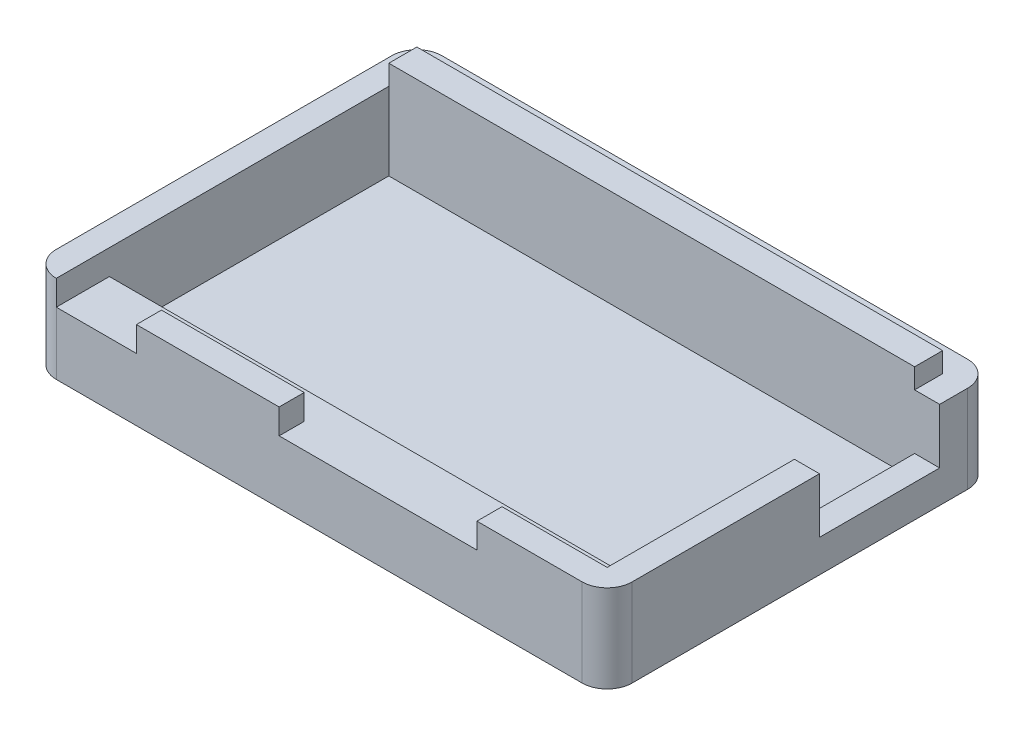
from build123d import *

# Parameters (mm, degrees)
SKETCH1_W            = 57.5
SKETCH1_H            = 38.5
SKETCH1_W_2          = 52.5
SKETCH1_H_2          = 33.5
BOSS_EXTRUDE1_DEPTH  = 10.25
SKETCH10_W           = 52.5
SKETCH10_H           = 33.5
BOSS_EXTRUDE8_DEPTH  = 2.5
SKETCH11_W           = 52.5
SKETCH11_H           = 2.8
BOSS_EXTRUDE9_DEPTH  = 9.75
SKETCH12_W           = 52.5
SKETCH12_H           = 2.8
BOSS_EXTRUDE10_DEPTH = 5.25
SKETCH13_W           = 12
SKETCH13_H           = 5.5
CUT_EXTRUDE1_DEPTH   = 2.5
SKETCH14_W           = 8
SKETCH14_H           = 2.5
SKETCH14_W_2         = 19.75
CUT_EXTRUDE2_DEPTH   = 2.5
SKETCH15_W           = 38.5
SKETCH15_H           = 1.5
CUT_EXTRUDE3_DEPTH   = 57.5
FILLET1_R            = 2.5


with BuildPart() as part:
    # Sketch1 → Boss-Extrude1 (new body)
    with BuildSketch(Plane(origin=(0, 0, 0), x_dir=(1, 0, 0), z_dir=(0, 1, 0))):
        with Locations((28.75, 19.25)):
            Rectangle(SKETCH1_W, SKETCH1_H)
        with Locations((28.75, 19.25)):
            Rectangle(SKETCH1_W_2, SKETCH1_H_2, mode=Mode.SUBTRACT)
    extrude(amount=BOSS_EXTRUDE1_DEPTH)

    # Sketch10 → Boss-Extrude8 (add)
    with BuildSketch(Plane(origin=(0, 0, 0), x_dir=(1, 0, 0), z_dir=(0, 1, 0))):
        with Locations((28.75, 19.25)):
            Rectangle(SKETCH10_W, SKETCH10_H)
    extrude(amount=BOSS_EXTRUDE8_DEPTH)

    # Sketch11 → Boss-Extrude9 (add)
    with BuildSketch(Plane(origin=(0, 2.5, 0), x_dir=(1, 0, 0), z_dir=(0, 1, 0))):
        with Locations((28.75, 34.6)):
            Rectangle(SKETCH11_W, SKETCH11_H)
    extrude(amount=BOSS_EXTRUDE9_DEPTH)

    # Sketch12 → Boss-Extrude10 (add)
    with BuildSketch(Plane(origin=(0, 2.5, 0), x_dir=(1, 0, 0), z_dir=(0, 1, 0))):
        with Locations((28.75, 3.9)):
            Rectangle(SKETCH12_W, SKETCH12_H)
    extrude(amount=BOSS_EXTRUDE10_DEPTH)

    # Sketch13 → Cut-Extrude1 (cut)
    with BuildSketch(Plane(origin=(57.5, 0, 0), x_dir=(0, 0, -1), z_dir=(1, 0, 0))):
        with Locations((27.2, 7.5)):
            Rectangle(SKETCH13_W, SKETCH13_H)
    extrude(amount=-CUT_EXTRUDE1_DEPTH, mode=Mode.SUBTRACT)

    # Sketch14 → Cut-Extrude2 (cut)
    with BuildSketch(Plane(origin=(0, 0, -2.5), x_dir=(-1, 0, 0), z_dir=(0, 0, -1))):
        with Locations((-6.5, 9)):
            Rectangle(SKETCH14_W, SKETCH14_H)
        with Locations((-34.625, 9)):
            Rectangle(SKETCH14_W_2, SKETCH14_H)
    extrude(amount=-CUT_EXTRUDE2_DEPTH, mode=Mode.SUBTRACT)

    # Sketch15 → Cut-Extrude3 (cut)
    with BuildSketch(Plane.ZY):
        with Locations((-19.25, 0.75)):
            Rectangle(SKETCH15_W, SKETCH15_H)
    extrude(amount=-CUT_EXTRUDE3_DEPTH, mode=Mode.SUBTRACT)

    # Fillet1
    fillet1_edges = [part.edges().sort_by_distance(p)[0] for p in [
        (0, 5.875, 0),
        (0, 5.875, -38.5),
        (57.5, 5.875, -38.5),
        (57.5, 5.875, 0),
    ]]
    fillet(fillet1_edges, radius=FILLET1_R)


solid = part.part
